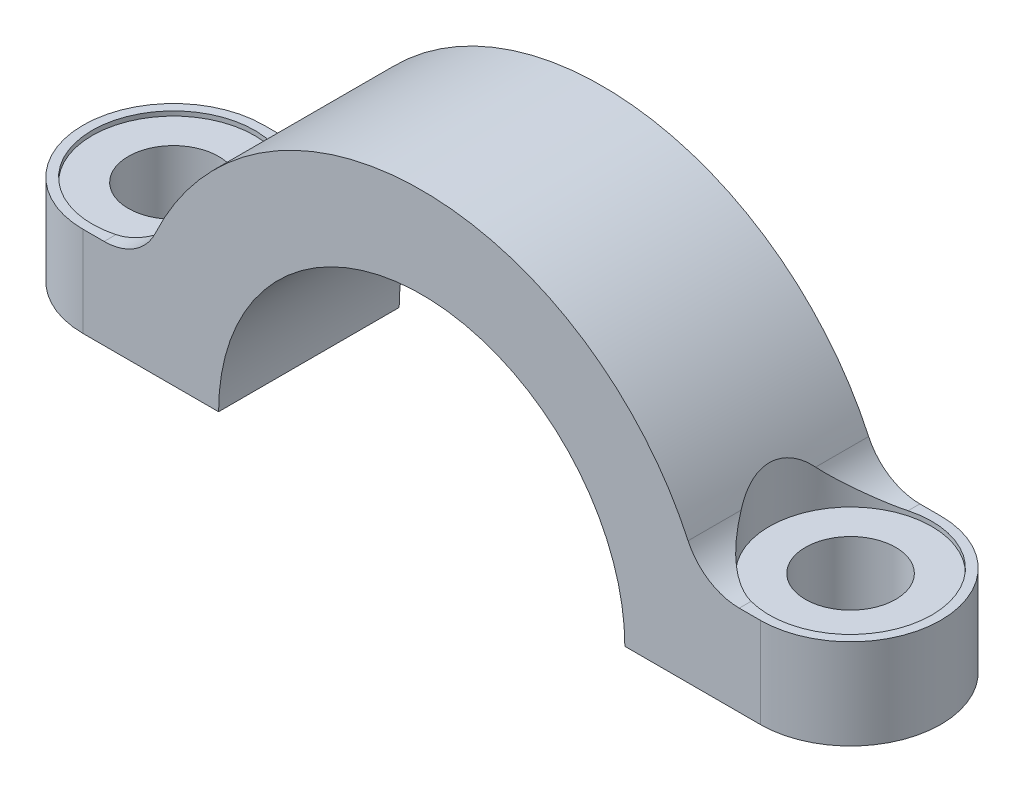
from build123d import *

# Parameters (mm, degrees)
BOSS_EXTRUDE1_DEPTH = 4
SKETCH2_R           = 2
CUT_EXTRUDE1_DEPTH  = 24.366642891
FILLET1_RADIUS      = 4
FILLET1_LENGTH      = 4
FILLET2_RADIUS      = 4
FILLET2_LENGTH      = 4
CUT_EXTRUDE2_START  = 3.8
SKETCH3_R           = 3.6
CUT_EXTRUDE2_DEPTH  = 20.566642908


with BuildPart() as part:
    # Sketch1 → Boss-Extrude1 (new, symmetric)
    with BuildSketch(Plane.XY):
        with BuildLine():
            Line((-19, 0), (-9, 0))
            ThreePointArc((-9, 0), (0, 9), (9, 0))
            Line((9, 0), (19, 0))
            Line((19, 0), (19, 4))
            Line((19, 4), (14.071247279, 4))
            ThreePointArc((14.071247279, 4), (12.724207514, 4.393941152), (11.801691267, 5.451612903))
            ThreePointArc((11.801691267, 5.451612903), (0, 13), (-11.801691267, 5.451612903))
            ThreePointArc((-11.801691267, 5.451612903), (-12.724207514, 4.393941152), (-14.071247279, 4))
            Line((-14.071247279, 4), (-19, 4))
            Line((-19, 4), (-19, 0))
        make_face()
    extrude(amount=BOSS_EXTRUDE1_DEPTH, both=True)

    # Sketch2 → Cut-Extrude1 (cut, through all)
    with BuildSketch(Plane(origin=(0, 0, 0), x_dir=(1, 0, 0), z_dir=(0, 1, 0))):
        with Locations(Location((15, 0, 0), (0, 0, 117.669868627))):
            Circle(SKETCH2_R)
        with Locations(Location((-15, 0, 0), (0, 0, 62.330131378))):
            Circle(SKETCH2_R)
    extrude(amount=CUT_EXTRUDE1_DEPTH, mode=Mode.SUBTRACT)

    # Fillet1: full round fillet: the end face becomes a half cylinder, R = half its width
    fillet1_face = Plane((19, 2, 0), x_dir=(0, 1, 0), z_dir=(1, 0, 0))  # on the end face: x along it, z out of the body
    fillet1_slab = fillet1_face.offset(-FILLET1_RADIUS / 2) * Box(FILLET1_LENGTH, 2 * FILLET1_RADIUS, FILLET1_RADIUS, mode=Mode.PRIVATE)  # the body's end, R deep
    fillet1_round = Plane((15, 2, 0), x_dir=(1, 0, 0), z_dir=(0, 1, 0)) * Cylinder(FILLET1_RADIUS, FILLET1_LENGTH, mode=Mode.PRIVATE)  # its axis R under the face
    add(fillet1_slab - fillet1_round, mode=Mode.SUBTRACT)

    # Fillet2: full round fillet: the end face becomes a half cylinder, R = half its width
    fillet2_face = Plane((-19, 2, 0), x_dir=(0, -1, 0), z_dir=(-1, 0, 0))  # on the end face: x along it, z out of the body
    fillet2_slab = fillet2_face.offset(-FILLET2_RADIUS / 2) * Box(FILLET2_LENGTH, 2 * FILLET2_RADIUS, FILLET2_RADIUS, mode=Mode.PRIVATE)  # the body's end, R deep
    fillet2_round = Plane((-15, 2, 0), x_dir=(-1, 0, 0), z_dir=(0, -1, 0)) * Cylinder(FILLET2_RADIUS, FILLET2_LENGTH, mode=Mode.PRIVATE)  # its axis R under the face
    add(fillet2_slab - fillet2_round, mode=Mode.SUBTRACT)

    # Sketch3 → Cut-Extrude2 (cut, through all)
    with BuildSketch(Plane(origin=(0, 0, 0), x_dir=(1, 0, 0), z_dir=(0, 1, 0)).offset(CUT_EXTRUDE2_START)):
        with Locations(Location((-15, 0, 0), (0, 0, 75.049356593))):
            Circle(SKETCH3_R)
        with Locations(Location((15, 0, 0), (0, 0, 104.950643407))):
            Circle(SKETCH3_R)
    extrude(amount=CUT_EXTRUDE2_DEPTH, mode=Mode.SUBTRACT)


solid = part.part
